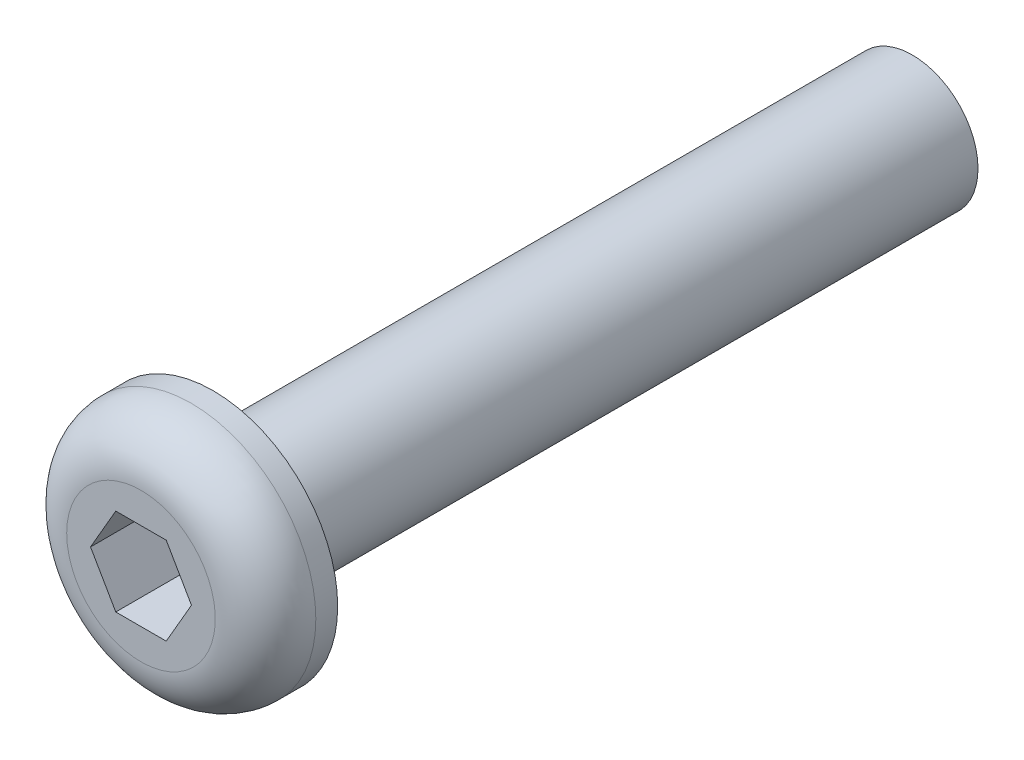
from build123d import *

# Parameters (mm, degrees)
SKETCH1_R          = 1.5
EXTRUDE1_DEPTH     = 16
CUT_EXTRUDE1_DEPTH = 2


with BuildPart() as part:
    # Sketch1 → Extrude1 (new body)
    with BuildSketch(Plane.XY):
        Circle(SKETCH1_R)
    extrude(amount=-EXTRUDE1_DEPTH)

    # Sketch2 → Revolve1 (revolve)
    with BuildSketch(Plane(origin=(0, 0, 0), x_dir=(0, 0, -1), z_dir=(1, 0, 0)), mode=Mode.PRIVATE) as revolve1_sk:
        with BuildLine():
            Line((0, 0), (0, 2.85))
            Line((0, 2.85), (-0.5, 2.85))
            ThreePointArc((-0.5, 2.85), (-1.313172798, 2.513172798), (-1.65, 1.7))
            Line((-1.65, 1.7), (-1.65, 0))
            Line((-1.65, 0), (0, 0))
        make_face()
    revolve(revolve1_sk.sketch.rotate(Axis((0, 0, 0), (0, 0, 1)), 90), axis=Axis((0, 0, 0), (0, 0, 1)))

    # Sketch3 → Cut-Extrude1 (cut)
    with BuildSketch(Plane.XY.offset(1.65)):
        Polygon((-0.577350269, 1), (-1.154700538, 0), (-0.577350269, -1), (0.577350269, -1), (1.154700538, 0), (0.577350269, 1), align=None)
    extrude(amount=-CUT_EXTRUDE1_DEPTH, mode=Mode.SUBTRACT)


solid = part.part
